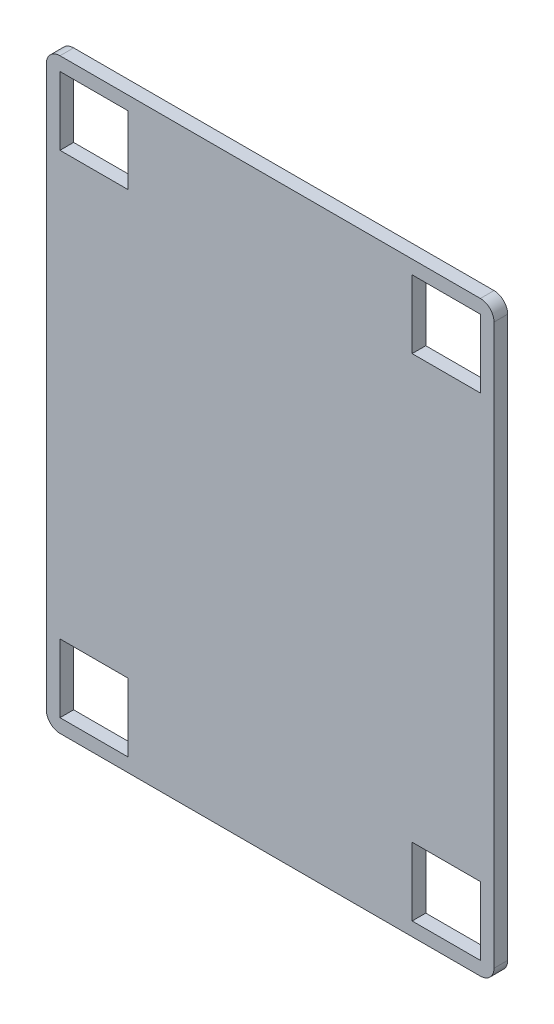
from build123d import *

# Parameters (mm, degrees)
ESQUISSE1_W             = 164
ESQUISSE1_H             = 215
BOSS_EXTRU_1_DEPTH      = 5
ESQUISSE2_W             = 25
ESQUISSE2_H             = 25
ENL_V_MAT_EXTRU_1_DEPTH = 5
CONG_1_R                = 5


with BuildPart() as part:
    # Esquisse1 → Boss.-Extru.1 (new body)
    with BuildSketch(Plane.XY):
        Rectangle(ESQUISSE1_W, ESQUISSE1_H)
    extrude(amount=BOSS_EXTRU_1_DEPTH)

    # Esquisse2 → Enlèv. mat.-Extru.1 (cut)
    with BuildSketch(Plane.XY):
        with Locations((-64.5, 90)):
            Rectangle(ESQUISSE2_W, ESQUISSE2_H)
        with Locations((64.5, 90)):
            Rectangle(ESQUISSE2_W, ESQUISSE2_H)
        with Locations((64.5, -90)):
            Rectangle(ESQUISSE2_W, ESQUISSE2_H)
        with Locations((-64.5, -90)):
            Rectangle(ESQUISSE2_W, ESQUISSE2_H)
    extrude(amount=ENL_V_MAT_EXTRU_1_DEPTH, mode=Mode.SUBTRACT)

    # Congé1
    cong_1_edges = [part.edges().sort_by_distance(p)[0] for p in [
        (-82, 107.5, 2.5),
        (82, 107.5, 2.5),
        (82, -107.5, 2.5),
        (-82, -107.5, 2.5),
    ]]
    fillet(cong_1_edges, radius=CONG_1_R)


solid = part.part
